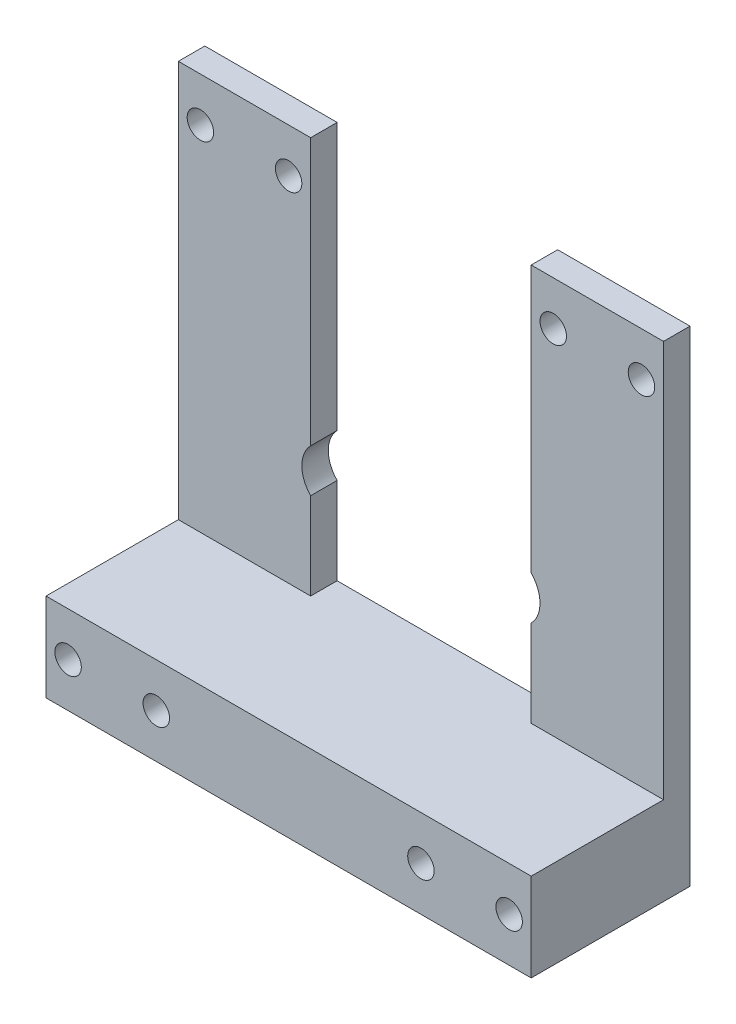
from build123d import *
from build123d.topology import SkipClean

# Parameters (mm, degrees)
SKETCH1_W           = 55
SKETCH1_H           = 10
SKETCH1_R           = 1.5
BOSS_EXTRUDE1_DEPTH = 15
BOSS_EXTRUDE2_START = 3
SKETCH2_W           = 25
SKETCH2_H           = 10
SKETCH2_R           = 1.5
SKETCH2_W_2         = 15
BOSS_EXTRUDE2_DEPTH = 3


with BuildPart() as part:
    # Sketch1 → Boss-Extrude1 (new body)
    with BuildSketch(Plane.XY):
        with Locations((-27.5, 5)):
            Rectangle(SKETCH1_W, SKETCH1_H)
        with Locations((-2.5, 5)):
            Circle(SKETCH1_R, mode=Mode.SUBTRACT)
        with Locations((-12.5, 5)):
            Circle(SKETCH1_R, mode=Mode.SUBTRACT)
        with Locations((-42.5, 5)):
            Circle(SKETCH1_R, mode=Mode.SUBTRACT)
        with Locations((-52.5, 5)):
            Circle(SKETCH1_R, mode=Mode.SUBTRACT)
    extrude(amount=BOSS_EXTRUDE1_DEPTH)

    # Sketch2 → Boss-Extrude2 (add)
    # profile 1 of 5: a face of its own
    with SkipClean():  # the faces are left unmerged after this step: merging them gives an invalid solid
        with BuildSketch(Plane(origin=(0, 0, 0), x_dir=(-1, 0, 0), z_dir=(0, 0, -1)).offset(BOSS_EXTRUDE2_START)):
            with Locations((27.5, 5)):
                Rectangle(SKETCH2_W, SKETCH2_H)
        # profile 2 of 5: a face of its own
        with BuildSketch(Plane(origin=(0, 0, 0), x_dir=(-1, 0, 0), z_dir=(0, 0, -1)).offset(BOSS_EXTRUDE2_START)):
            with BuildLine():
                Line((0, 55), (0, 10))
                Line((0, 10), (15, 10))
                Line((15, 10), (15, 19.850540474))
                ThreePointArc((15, 19.850540474), (14, 22.300030217), (15, 24.74951996))
                Line((15, 24.74951996), (15, 55))
                Line((15, 55), (0, 55))
            make_face()
            with Locations((2.5, 50)):
                Circle(SKETCH2_R, mode=Mode.SUBTRACT)
            with Locations((12.5, 50)):
                Circle(SKETCH2_R, mode=Mode.SUBTRACT)
        # profile 3 of 5: a face of its own
        with BuildSketch(Plane(origin=(0, 0, 0), x_dir=(-1, 0, 0), z_dir=(0, 0, -1)).offset(BOSS_EXTRUDE2_START)):
            with Locations((7.5, 5)):
                Rectangle(SKETCH2_W_2, SKETCH2_H)
            with Locations((2.5, 5)):
                Circle(SKETCH2_R, mode=Mode.SUBTRACT)
            with Locations((12.5, 5)):
                Circle(SKETCH2_R, mode=Mode.SUBTRACT)
        # profile 4 of 5: a face of its own
        with BuildSketch(Plane(origin=(0, 0, 0), x_dir=(-1, 0, 0), z_dir=(0, 0, -1)).offset(BOSS_EXTRUDE2_START)):
            with Locations((47.5, 5)):
                Rectangle(SKETCH2_W_2, SKETCH2_H)
            with Locations((42.5, 5)):
                Circle(SKETCH2_R, mode=Mode.SUBTRACT)
            with Locations((52.5, 5)):
                Circle(SKETCH2_R, mode=Mode.SUBTRACT)
        # profile 5 of 5: a face of its own
        with BuildSketch(Plane(origin=(0, 0, 0), x_dir=(-1, 0, 0), z_dir=(0, 0, -1)).offset(BOSS_EXTRUDE2_START)):
            with BuildLine():
                Line((40, 19.850540474), (40, 10))
                Line((40, 10), (55, 10))
                Line((55, 10), (55, 55))
                Line((55, 55), (40, 55))
                Line((40, 55), (40, 24.74951996))
                ThreePointArc((40, 24.74951996), (40.740370349, 23.622905872), (41, 22.300030217))
                ThreePointArc((41, 22.300030217), (40.740370349, 20.977154561), (40, 19.850540474))
            make_face()
            with Locations((42.5, 50)):
                Circle(SKETCH2_R, mode=Mode.SUBTRACT)
            with Locations((52.5, 50)):
                Circle(SKETCH2_R, mode=Mode.SUBTRACT)
        extrude(amount=-BOSS_EXTRUDE2_DEPTH)


solid = part.part
